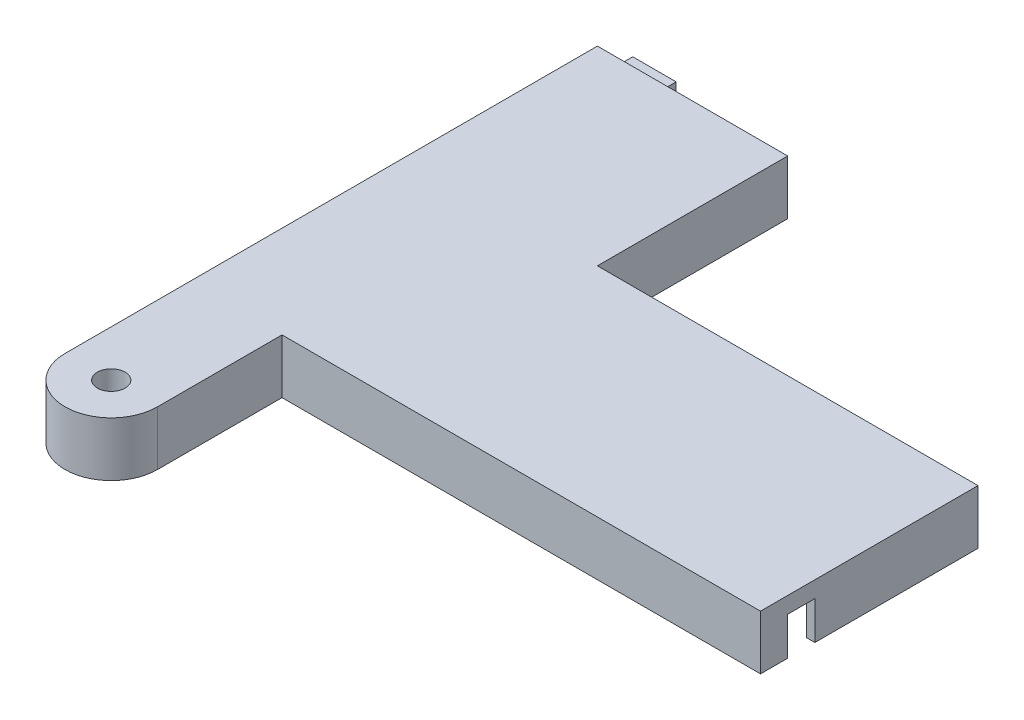
from build123d import *

# Parameters (mm, degrees)
CORNERBOSS_EXTRUDE1_DEPTH               = 20
SHELL4_T                                = -3
PADSKETCH2_R                            = 12
PADBOSS_EXTRUDE2_DEPTH                  = 10
STEPPERSHAFTHOLECUTSKETCH3_R            = 5.1
STEPPERSHAFTHOLECUT_EXTRUDE1_DEPTH      = 288.430740571
THREADEDNUTMOUNTHOLESSKETCH4_R          = 2
THREADEDNUTMOUNTHOLESCUT_EXTRUDE2_DEPTH = 10
BRPEGHOLESKETCH1_W                      = 10
BRPEGHOLESKETCH1_H                      = 14
BRPEGHOLECUT_EXTRUDE1_DEPTH             = 3
TOPPEGSKETCH2_W                         = 9.8
TOPPEGSKETCH2_H                         = 13.9
TOPPEGBOSS_EXTRUDE1_DEPTH               = 3
TOPPEGCAPSKETCH3_W                      = 16
TOPPEGCAPSKETCH3_H                      = 17
TOPPEGCAPBOSS_EXTRUDE2_DEPTH            = 3.1
CENTERPEGHOLECUTSKETCH1_W               = 10
CENTERPEGHOLECUTSKETCH1_H               = 14
CENTERPEGHOLECUT_EXTRUDE1_DEPTH         = 3


with BuildPart() as part:
    # CornerrSketch1 → CornerBoss-Extrude1 (new body)
    with BuildSketch(Plane(origin=(0, 0, 0), x_dir=(1, 0, 0), z_dir=(0, 1, 0))):
        with BuildLine():
            Line((0, 195.825), (70, 195.825))
            Line((70, 195.825), (70, 125.825))
            Line((70, 125.825), (210, 125.825))
            Line((210, 125.825), (210, 45.825))
            Line((210, 45.825), (34, 45.825))
            Line((34, 45.825), (34, 0))
            ThreePointArc((34, 0), (17, -17), (0, 0))
            Line((0, 0), (0, 195.825))
        make_face()
    extrude(amount=CORNERBOSS_EXTRUDE1_DEPTH)

    # Shell4
    shell4_openings = [part.faces().sort_by_distance(p)[0] for p in [
        (83.067785517, 0, -95.408443826),
    ]]
    offset(amount=SHELL4_T, openings=shell4_openings, kind=Kind.INTERSECTION)

    # PadSketch2 → PadBoss-Extrude2 (add)
    with BuildSketch(Plane.XZ.offset(-17)):
        with Locations(Location((17, 0, 0), (0, 0, 90))):
            Circle(PADSKETCH2_R)
    extrude(amount=PADBOSS_EXTRUDE2_DEPTH)

    # StepperShaftHoleCutSketch3 → StepperShaftHoleCut-Extrude1 (cut, through all)
    with BuildSketch(Plane.XZ.offset(-7)):
        with Locations(Location((17, 0, 0), (0, 0, 270))):
            Circle(STEPPERSHAFTHOLECUTSKETCH3_R)
    extrude(amount=-STEPPERSHAFTHOLECUT_EXTRUDE1_DEPTH, mode=Mode.SUBTRACT)

    # ThreadedNutMountHolesSketch4 → ThreadedNutMountHolesCut-Extrude2 (cut)
    with BuildSketch(Plane(origin=(0, 7, 0), x_dir=(-1, 0, 0), z_dir=(0, -1, 0))):
        with Locations(Location((-17, 8, 0), (0, 0, 90))):
            Circle(THREADEDNUTMOUNTHOLESSKETCH4_R)
        with Locations(Location((-17, -8, 0), (0, 0, 90))):
            Circle(THREADEDNUTMOUNTHOLESSKETCH4_R)
        with Locations(Location((-25, 0, 0), (0, 0, 90))):
            Circle(THREADEDNUTMOUNTHOLESSKETCH4_R)
        with Locations(Location((-9, 0, 0), (0, 0, 90))):
            Circle(THREADEDNUTMOUNTHOLESSKETCH4_R)
    extrude(amount=-THREADEDNUTMOUNTHOLESCUT_EXTRUDE2_DEPTH, mode=Mode.SUBTRACT)

    # BRPegHoleSketch1 → BRPegHoleCut-Extrude1 (cut)
    with BuildSketch(Plane(origin=(210, 0, 0), x_dir=(0, 0, -1), z_dir=(1, 0, 0))):
        with Locations((60.825, 7)):
            Rectangle(BRPEGHOLESKETCH1_W, BRPEGHOLESKETCH1_H)
    extrude(amount=-BRPEGHOLECUT_EXTRUDE1_DEPTH, mode=Mode.SUBTRACT)

    # TopPegSketch2 → TopPegBoss-Extrude1 (add)
    with BuildSketch(Plane(origin=(0, 0, -195.825), x_dir=(-1, 0, 0), z_dir=(0, 0, -1))):
        with Locations((-15, 6.95)):
            Rectangle(TOPPEGSKETCH2_W, TOPPEGSKETCH2_H)
    extrude(amount=TOPPEGBOSS_EXTRUDE1_DEPTH)

    # TopPegCapSketch3 → TopPegCapBoss-Extrude2 (add)
    with BuildSketch(Plane(origin=(0, 0, -198.825), x_dir=(-1, 0, 0), z_dir=(0, 0, -1))):
        with Locations((-14.9, 8.5)):
            Rectangle(TOPPEGCAPSKETCH3_W, TOPPEGCAPSKETCH3_H)
    extrude(amount=TOPPEGCAPBOSS_EXTRUDE2_DEPTH)

    # CenterPegHoleCutSketch1 → CenterPegHoleCut-Extrude1 (cut)
    with BuildSketch(Plane(origin=(0, 0, -125.825), x_dir=(-1, 0, 0), z_dir=(0, 0, -1))):
        with Locations((-175, 7)):
            Rectangle(CENTERPEGHOLECUTSKETCH1_W, CENTERPEGHOLECUTSKETCH1_H)
    extrude(amount=-CENTERPEGHOLECUT_EXTRUDE1_DEPTH, mode=Mode.SUBTRACT)


solid = part.part
